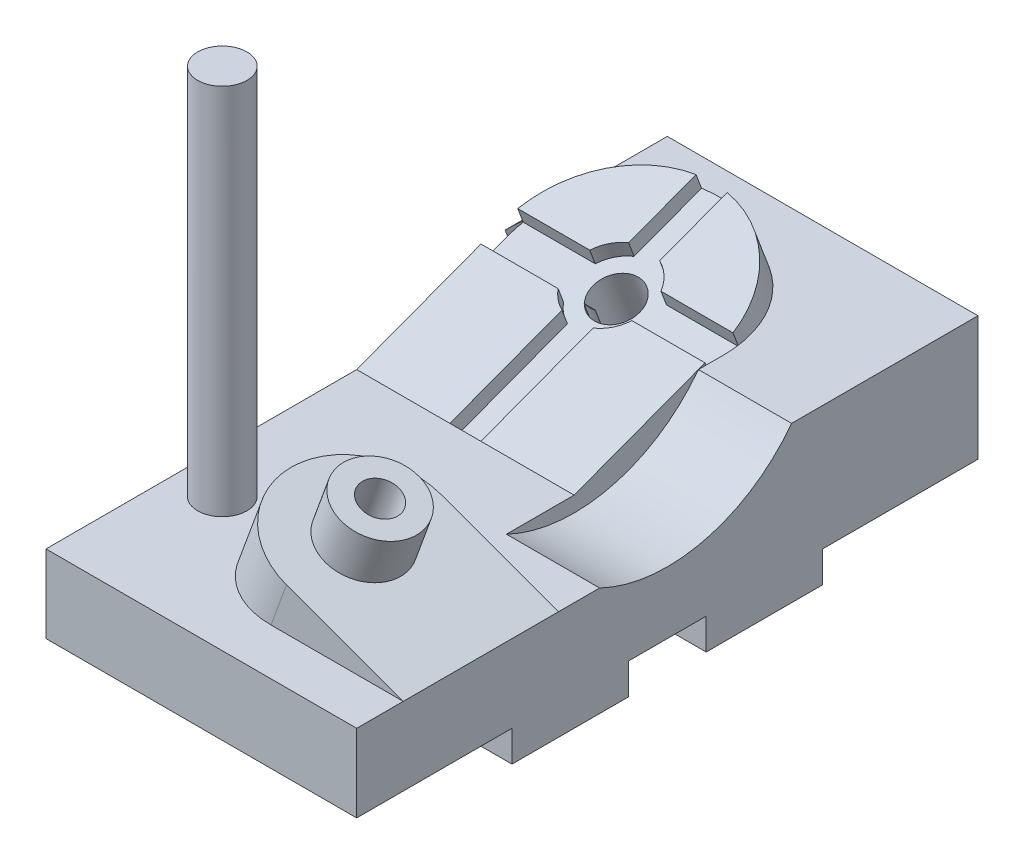
from build123d import *

# Parameters (mm, degrees)
BOSS_EXTRUDE1_DEPTH = 30
BOSS_EXTRUDE2_DEPTH = 70
BOSS_EXTRUDE4_DEPTH = 25
SKETCH3_10_R        = 7.5
CUT_EXTRUDE3_DEPTH  = 5
CUT_EXTRUDE4_DEPTH  = 189.525149763
BOSS_EXTRUDE5_REACH = 196.445
SKETCH10_R          = 12.5
SKETCH10_3_R        = 12.5
SKETCH10_3_R_2      = 6
BOSS_EXTRUDE6_DEPTH = 15
SKETCH10_4_R        = 6
CUT_EXTRUDE5_DEPTH  = 195.445323253
SKETCH11_R          = 7.938683864
BOSS_EXTRUDE7_DEPTH = 120


with BuildPart() as part:
    # Sketch1 → Boss-Extrude1 (new body)
    with BuildSketch(Plane(origin=(0, 0, 0), x_dir=(0, 0, -1), z_dir=(1, 0, 0))):
        with BuildLine():
            Line((173.889938751, 19.67846657), (173.889938751, -20.32153343))
            Line((173.889938751, -20.32153343), (123.889938751, -20.32153343))
            Line((123.889938751, -20.32153343), (123.889938751, -30.32153343))
            Line((123.889938751, -30.32153343), (86.389938751, -30.32153343))
            Line((86.389938751, -30.32153343), (86.389938751, -20.32153343))
            Line((86.389938751, -20.32153343), (61.389938751, -20.32153343))
            Line((61.389938751, -20.32153343), (61.389938751, -30.32153343))
            Line((61.389938751, -30.32153343), (23.889938751, -30.32153343))
            Line((23.889938751, -30.32153343), (23.889938751, -20.32153343))
            Line((23.889938751, -20.32153343), (-26.110061249, -20.32153343))
            Line((-26.110061249, -20.32153343), (-26.110061249, 4.67846657))
            Line((-26.110061249, 4.67846657), (52.095444034, 4.67846657))
            ThreePointArc((52.095444034, 4.67846657), (85.684433469, 1.089477135), (113.889938751, 19.67846657))
            Line((113.889938751, 19.67846657), (173.889938751, 19.67846657))
        make_face()
    extrude(amount=BOSS_EXTRUDE1_DEPTH)

    # Sketch2 → Boss-Extrude2 (add)
    with BuildSketch(Plane.ZY):
        Polygon((26.110061249, 4.67846657), (-73.889938751, 4.67846657), (-113.889938751, 19.67846657), (-173.889938751, 19.67846657), (-173.889938751, -20.32153343), (-123.889938751, -20.32153343), (-123.889938751, -30.32153343), (-86.389938751, -30.32153343), (-86.389938751, -20.32153343), (-61.389938751, -20.32153343), (-61.389938751, -30.32153343), (-23.889938751, -30.32153343), (-23.889938751, -20.32153343), (26.110061249, -20.32153343), align=None)
    extrude(amount=BOSS_EXTRUDE2_DEPTH)

    # Sketch3 → Boss-Extrude4 (add)
    with BuildSketch(Plane(origin=(0, -20.190913281, -7.571592481), x_dir=(1, 0, 0), z_dir=(0, 0.9363291775690461, 0.35112344158838765))):
        with BuildLine():
            Line((-70, 120.828024865), (-70, 70.828024865))
            Line((-70, 70.828024865), (0, 70.828024865))
            Line((0, 70.828024865), (0, 120.828024865))
            ThreePointArc((0, 120.828024865), (-35, 155.828024865), (-70, 120.828024865))
        make_face()
        with BuildLine():
            ThreePointArc((-33.196705055, 113.548043592), (-35, 113.328024865), (-36.803294945, 113.548043592))
            Line((-36.803294945, 113.548043592), (-33.196705055, 113.548043592))
        make_face(mode=Mode.SUBTRACT)
    extrude(amount=-BOSS_EXTRUDE4_DEPTH)

    # Sketch3<10> → Cut-Extrude3 (cut)
    with BuildSketch(Plane(origin=(0, -20.190913281, -7.571592481), x_dir=(1, 0, 0), z_dir=(0, 0.9363291775690461, 0.35112344158838765))):
        with BuildLine():
            Line((-70, 120.828024865), (-70, 113.548043592))
            Line((-70, 113.548043592), (-45.161292864, 113.548043592))
            ThreePointArc((-45.161292864, 113.548043592), (-42.863008369, 111.110869963), (-40, 109.371585628))
            Line((-40, 109.371585628), (-40, 70.828024865))
            Line((-40, 70.828024865), (-30, 70.828024865))
            Line((-30, 70.828024865), (-30, 109.371585628))
            ThreePointArc((-30, 109.371585628), (-26.161165235, 111.9891901), (-23.543560763, 115.828024865))
            Line((-23.543560763, 115.828024865), (0, 115.828024865))
            Line((0, 115.828024865), (0, 120.828024865))
            ThreePointArc((0, 120.828024865), (-0.08986132, 123.334460053), (-0.358983849, 125.828024865))
            Line((-0.358983849, 125.828024865), (-23.543560763, 125.828024865))
            ThreePointArc((-23.543560763, 125.828024865), (-26.161165235, 129.66685963), (-30, 132.284464103))
            Line((-30, 132.284464103), (-30, 155.469041017))
            ThreePointArc((-30, 155.469041017), (-35, 155.828024865), (-40, 155.469041017))
            Line((-40, 155.469041017), (-40, 132.284464103))
            ThreePointArc((-40, 132.284464103), (-43.838834765, 129.66685963), (-46.456439237, 125.828024865))
            Line((-46.456439237, 125.828024865), (-69.641016151, 125.828024865))
            ThreePointArc((-69.641016151, 125.828024865), (-69.91013868, 123.334460053), (-70, 120.828024865))
        make_face()
        with Locations((-35, 120.828024865)):
            Circle(SKETCH3_10_R, mode=Mode.SUBTRACT)
    extrude(amount=-CUT_EXTRUDE3_DEPTH, mode=Mode.SUBTRACT)

    # Sketch3<11> → Cut-Extrude4 (cut, through all)
    with BuildSketch(Plane(origin=(0, -20.190913281, -7.571592481), x_dir=(1, 0, 0), z_dir=(0, 0.9363291775690461, 0.35112344158838765))):
        with BuildLine():
            ThreePointArc((-27.5, 120.828024865), (-39.621974032, 126.734576824), (-36.803294945, 113.548043592))
            Line((-36.803294945, 113.548043592), (-33.196705055, 113.548043592))
            ThreePointArc((-33.196705055, 113.548043592), (-29.093448041, 116.206050833), (-27.5, 120.828024865))
        make_face()
    extrude(amount=-CUT_EXTRUDE4_DEPTH, mode=Mode.SUBTRACT)

    # Boss-Extrude5: up to this face of the body (flat: up to its plane)
    boss_extrude5_end = Plane(part.part.faces().sort_by_distance((-22.448514344, 4.67846657, -21.154405873))[0])
    # Sketch10 → Boss-Extrude5 (add, up to the picked face)
    with BuildSketch(Plane(origin=(5.012963525, 13.77300409, 0), x_dir=(0.9396926207859082, -0.3420201433256694, 0), z_dir=(0.3420201433256694, 0.9396926207859083, 0)), mode=Mode.PRIVATE) as boss_extrude5_sk1:
        with BuildLine():
            Line((-13.409351183, -11.110061249), (26.590648817, -11.110061249))
            Line((26.590648817, -11.110061249), (26.590648817, 38.889938751))
            Line((26.590648817, 38.889938751), (-13.409351183, 38.889938751))
            ThreePointArc((-13.409351183, 38.889938751), (-38.409351183, 13.889938751), (-13.409351183, -11.110061249))
        make_face()
        with Locations((-13.409351183, 13.889938751)):
            Circle(SKETCH10_R, mode=Mode.SUBTRACT)
    boss_extrude5_tool1 = split(extrude(boss_extrude5_sk1.sketch, amount=-BOSS_EXTRUDE5_REACH, mode=Mode.PRIVATE), bisect_by=boss_extrude5_end, keep=Keep.BOTH, mode=Mode.PRIVATE)
    add(boss_extrude5_tool1.solids().sort_by(Axis((-30.309415, 26.629299, -13.889939), (-0.3420201433256694, -0.9396926207859083, 0)))[0])

    # Sketch10<4> → Cut-Extrude5 (cut, through all)
    with BuildSketch(Plane(origin=(5.012963525, 13.77300409, 0), x_dir=(0.9396926207859082, -0.3420201433256694, 0), z_dir=(0.3420201433256694, 0.9396926207859083, 0))):
        with Locations((-13.409351183, 13.889938751)):
            Circle(SKETCH10_4_R)
    extrude(amount=-CUT_EXTRUDE5_DEPTH, mode=Mode.SUBTRACT)

    # Sketch11 → Boss-Extrude7 (add)
    with BuildSketch(Plane(origin=(0, 4.67846657, 0), x_dir=(1, 0, 0), z_dir=(0, 1, 0))):
        with Locations((-56.205003801, 16.850900171)):
            Circle(SKETCH11_R)
    extrude(amount=BOSS_EXTRUDE7_DEPTH)


with BuildPart() as body_2:
    # Sketch10<3> → Boss-Extrude6 (new, symmetric)
    with BuildSketch(Plane(origin=(5.012963525, 13.77300409, 0), x_dir=(0.9396926207859082, -0.3420201433256694, 0), z_dir=(0.3420201433256694, 0.9396926207859083, 0))):
        with Locations((-13.409351183, 13.889938751)):
            Circle(SKETCH10_3_R)
        with Locations((-13.409351183, 13.889938751)):
            Circle(SKETCH10_3_R_2, mode=Mode.SUBTRACT)
    extrude(amount=BOSS_EXTRUDE6_DEPTH, both=True)


solid = Compound([part.part, body_2.part])
